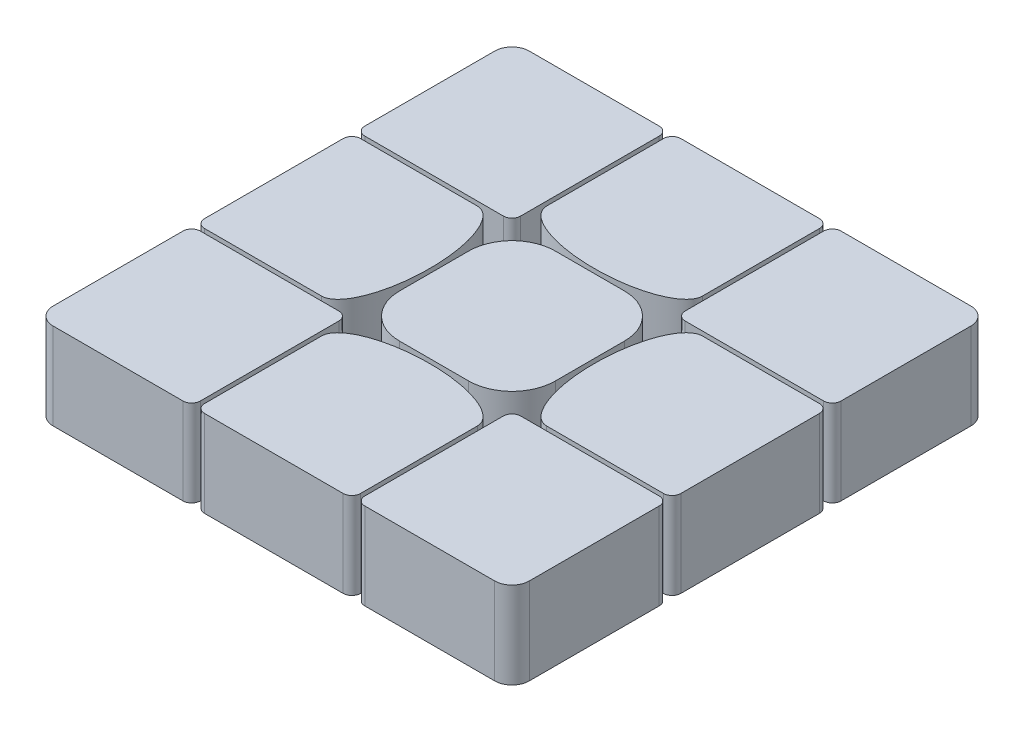
from build123d import *

# Parameters (mm, degrees)
BOSS_EXTRUDE1_DEPTH   = 10
BOSS_EXTRUDE1_2_DEPTH = 10
BOSS_EXTRUDE1_3_DEPTH = 10
BOSS_EXTRUDE1_4_DEPTH = 10
BOSS_EXTRUDE1_5_DEPTH = 10
BOSS_EXTRUDE1_6_DEPTH = 10
BOSS_EXTRUDE1_7_DEPTH = 10
BOSS_EXTRUDE1_8_DEPTH = 10
BOSS_EXTRUDE1_9_DEPTH = 10


with BuildPart() as part:
    # Sketch2 → Boss-Extrude1 (new body)
    with BuildSketch(Plane(origin=(0, 0, 0), x_dir=(1, 0, 0), z_dir=(0, 1, 0))):
        with BuildLine():
            Line((80.105220523, 19.703918666), (95.105220523, 19.703918666))
            ThreePointArc((95.105220523, 19.703918666), (95.812327305, 19.411025447), (96.105220523, 18.703918666))
            Line((96.105220523, 18.703918666), (96.105220523, 2.703918666))
            ThreePointArc((96.105220523, 2.703918666), (95.812327305, 1.996811885), (95.105220523, 1.703918666))
            Line((95.105220523, 1.703918666), (79.105220523, 1.703918666))
            ThreePointArc((79.105220523, 1.703918666), (78.398113742, 1.996811885), (78.105220523, 2.703918666))
            Line((78.105220523, 2.703918666), (78.105220523, 17.703918666))
            ThreePointArc((78.105220523, 17.703918666), (78.691006961, 19.118132229), (80.105220523, 19.703918666))
        make_face()
    extrude(amount=BOSS_EXTRUDE1_DEPTH)


with BuildPart() as body_2:
    # Sketch2 → Boss-Extrude1 2 (new body)
    with BuildSketch(Plane(origin=(0, 0, 0), x_dir=(1, 0, 0), z_dir=(0, 1, 0))):
        with BuildLine():
            Line((96.605220523, -3.796081334), (96.605220523, -11.796081334))
            ThreePointArc((96.605220523, -11.796081334), (98.069686617, -15.33161524), (101.605220523, -16.796081334))
            Line((101.605220523, -16.796081334), (109.605220523, -16.796081334))
            ThreePointArc((109.605220523, -16.796081334), (113.140754429, -15.33161524), (114.605220523, -11.796081334))
            Line((114.605220523, -11.796081334), (114.605220523, -3.796081334))
            ThreePointArc((114.605220523, -3.796081334), (113.140754429, -0.260547428), (109.605220523, 1.203918666))
            Line((109.605220523, 1.203918666), (101.605220523, 1.203918666))
            ThreePointArc((101.605220523, 1.203918666), (98.069686617, -0.260547428), (96.605220523, -3.796081334))
        make_face()
    extrude(amount=BOSS_EXTRUDE1_2_DEPTH)


with BuildPart() as body_3:
    # Sketch2 → Boss-Extrude1 3 (new body)
    with BuildSketch(Plane(origin=(0, 0, 0), x_dir=(1, 0, 0), z_dir=(0, 1, 0))):
        with BuildLine():
            Line((79.105220523, 1.203918666), (92.605220523, 1.203918666))
            add(Edge.make_bspline(
                [(92.605220523, -16.796081334), (96.105220523, -16.796081334), (96.105220523, -7.796081334), (96.105220523, 1.203918666), (92.605220523, 1.203918666)],
                knots=[3.141592654, 3.141592654, 3.141592654, 4.71238898, 4.71238898, 6.283185307, 6.283185307, 6.283185307], degree=2, weights=[1, 0.707106781, 1, 0.707106781, 1]))
            Line((92.605220523, -16.796081334), (79.105220523, -16.796081334))
            ThreePointArc((79.105220523, -16.796081334), (78.398113742, -16.503188115), (78.105220523, -15.796081334))
            Line((78.105220523, -15.796081334), (78.105220523, 0.203918666))
            ThreePointArc((78.105220523, 0.203918666), (78.398113742, 0.911025447), (79.105220523, 1.203918666))
        make_face()
    extrude(amount=BOSS_EXTRUDE1_3_DEPTH)


with BuildPart() as body_4:
    # Sketch2 → Boss-Extrude1 4 (new body)
    with BuildSketch(Plane(origin=(0, 0, 0), x_dir=(1, 0, 0), z_dir=(0, 1, 0))):
        with BuildLine():
            Line((97.605220523, 19.703918666), (113.605220523, 19.703918666))
            ThreePointArc((113.605220523, 19.703918666), (114.312327305, 19.411025447), (114.605220523, 18.703918666))
            Line((114.605220523, 18.703918666), (114.605220523, 5.203918666))
            add(Edge.make_bspline(
                [(96.605220523, 5.203918666), (96.605220523, 1.703918666), (105.605220523, 1.703918666), (114.605220523, 1.703918666), (114.605220523, 5.203918666)],
                knots=[0, 0, 0, 1.570796327, 1.570796327, 3.141592654, 3.141592654, 3.141592654], degree=2, weights=[1, 0.707106781, 1, 0.707106781, 1]))
            Line((96.605220523, 5.203918666), (96.605220523, 18.703918666))
            ThreePointArc((96.605220523, 18.703918666), (96.898113742, 19.411025447), (97.605220523, 19.703918666))
        make_face()
    extrude(amount=BOSS_EXTRUDE1_4_DEPTH)


with BuildPart() as body_5:
    # Sketch2 → Boss-Extrude1 5 (new body)
    with BuildSketch(Plane(origin=(0, 0, 0), x_dir=(1, 0, 0), z_dir=(0, 1, 0))):
        with BuildLine():
            Line((133.105220523, 17.703918666), (133.105220523, 2.703918666))
            ThreePointArc((133.105220523, 2.703918666), (132.812327305, 1.996811885), (132.105220523, 1.703918666))
            Line((132.105220523, 1.703918666), (116.105220523, 1.703918666))
            ThreePointArc((116.105220523, 1.703918666), (115.398113742, 1.996811885), (115.105220523, 2.703918666))
            Line((115.105220523, 2.703918666), (115.105220523, 18.703918666))
            ThreePointArc((115.105220523, 18.703918666), (115.398113742, 19.411025447), (116.105220523, 19.703918666))
            Line((116.105220523, 19.703918666), (131.105220523, 19.703918666))
            ThreePointArc((131.105220523, 19.703918666), (132.519434086, 19.118132229), (133.105220523, 17.703918666))
        make_face()
    extrude(amount=BOSS_EXTRUDE1_5_DEPTH)


with BuildPart() as body_6:
    # Sketch2 → Boss-Extrude1 6 (new body)
    with BuildSketch(Plane(origin=(0, 0, 0), x_dir=(1, 0, 0), z_dir=(0, 1, 0))):
        with BuildLine():
            Line((133.105220523, 0.203918666), (133.105220523, -15.796081334))
            ThreePointArc((133.105220523, -15.796081334), (132.812327305, -16.503188115), (132.105220523, -16.796081334))
            Line((132.105220523, -16.796081334), (118.605220523, -16.796081334))
            add(Edge.make_bspline(
                [(118.605220523, 1.203918666), (115.105220523, 1.203918666), (115.105220523, -7.796081334), (115.105220523, -16.796081334), (118.605220523, -16.796081334)],
                knots=[0, 0, 0, 1.570796327, 1.570796327, 3.141592654, 3.141592654, 3.141592654], degree=2, weights=[1, 0.707106781, 1, 0.707106781, 1]))
            Line((118.605220523, 1.203918666), (132.105220523, 1.203918666))
            ThreePointArc((132.105220523, 1.203918666), (132.812327305, 0.911025447), (133.105220523, 0.203918666))
        make_face()
    extrude(amount=BOSS_EXTRUDE1_6_DEPTH)


with BuildPart() as body_7:
    # Sketch2 → Boss-Extrude1 7 (new body)
    with BuildSketch(Plane(origin=(0, 0, 0), x_dir=(1, 0, 0), z_dir=(0, 1, 0))):
        with BuildLine():
            Line((131.105220523, -35.296081334), (116.105220523, -35.296081334))
            ThreePointArc((116.105220523, -35.296081334), (115.398113742, -35.003188115), (115.105220523, -34.296081334))
            Line((115.105220523, -34.296081334), (115.105220523, -18.296081334))
            ThreePointArc((115.105220523, -18.296081334), (115.398113742, -17.588974553), (116.105220523, -17.296081334))
            Line((116.105220523, -17.296081334), (132.105220523, -17.296081334))
            ThreePointArc((132.105220523, -17.296081334), (132.812327305, -17.588974553), (133.105220523, -18.296081334))
            Line((133.105220523, -18.296081334), (133.105220523, -33.296081334))
            ThreePointArc((133.105220523, -33.296081334), (132.519434086, -34.710294896), (131.105220523, -35.296081334))
        make_face()
    extrude(amount=BOSS_EXTRUDE1_7_DEPTH)


with BuildPart() as body_8:
    # Sketch2 → Boss-Extrude1 8 (new body)
    with BuildSketch(Plane(origin=(0, 0, 0), x_dir=(1, 0, 0), z_dir=(0, 1, 0))):
        with BuildLine():
            Line((114.605220523, -34.296081334), (114.605220523, -20.796081334))
            add(Edge.make_bspline(
                [(114.605220523, -20.796081334), (114.605220523, -17.296081334), (105.605220523, -17.296081334), (96.605220523, -17.296081334), (96.605220523, -20.796081334)],
                knots=[3.141592654, 3.141592654, 3.141592654, 4.71238898, 4.71238898, 6.283185307, 6.283185307, 6.283185307], degree=2, weights=[1, 0.707106781, 1, 0.707106781, 1]))
            Line((96.605220523, -20.796081334), (96.605220523, -34.296081334))
            ThreePointArc((96.605220523, -34.296081334), (96.898113742, -35.003188115), (97.605220523, -35.296081334))
            Line((97.605220523, -35.296081334), (113.605220523, -35.296081334))
            ThreePointArc((113.605220523, -35.296081334), (114.312327305, -35.003188115), (114.605220523, -34.296081334))
        make_face()
    extrude(amount=BOSS_EXTRUDE1_8_DEPTH)


with BuildPart() as body_9:
    # Sketch2 → Boss-Extrude1 9 (new body)
    with BuildSketch(Plane(origin=(0, 0, 0), x_dir=(1, 0, 0), z_dir=(0, 1, 0))):
        with BuildLine():
            Line((78.105220523, -33.296081334), (78.105220523, -18.296081334))
            ThreePointArc((78.105220523, -18.296081334), (78.398113742, -17.588974553), (79.105220523, -17.296081334))
            Line((79.105220523, -17.296081334), (95.105220523, -17.296081334))
            ThreePointArc((95.105220523, -17.296081334), (95.812327305, -17.588974553), (96.105220523, -18.296081334))
            Line((96.105220523, -18.296081334), (96.105220523, -34.296081334))
            ThreePointArc((96.105220523, -34.296081334), (95.812327305, -35.003188115), (95.105220523, -35.296081334))
            Line((95.105220523, -35.296081334), (80.105220523, -35.296081334))
            ThreePointArc((80.105220523, -35.296081334), (78.691006961, -34.710294896), (78.105220523, -33.296081334))
        make_face()
    extrude(amount=BOSS_EXTRUDE1_9_DEPTH)


solid = Compound([part.part, body_2.part, body_3.part, body_4.part, body_5.part, body_6.part, body_7.part, body_8.part, body_9.part])
